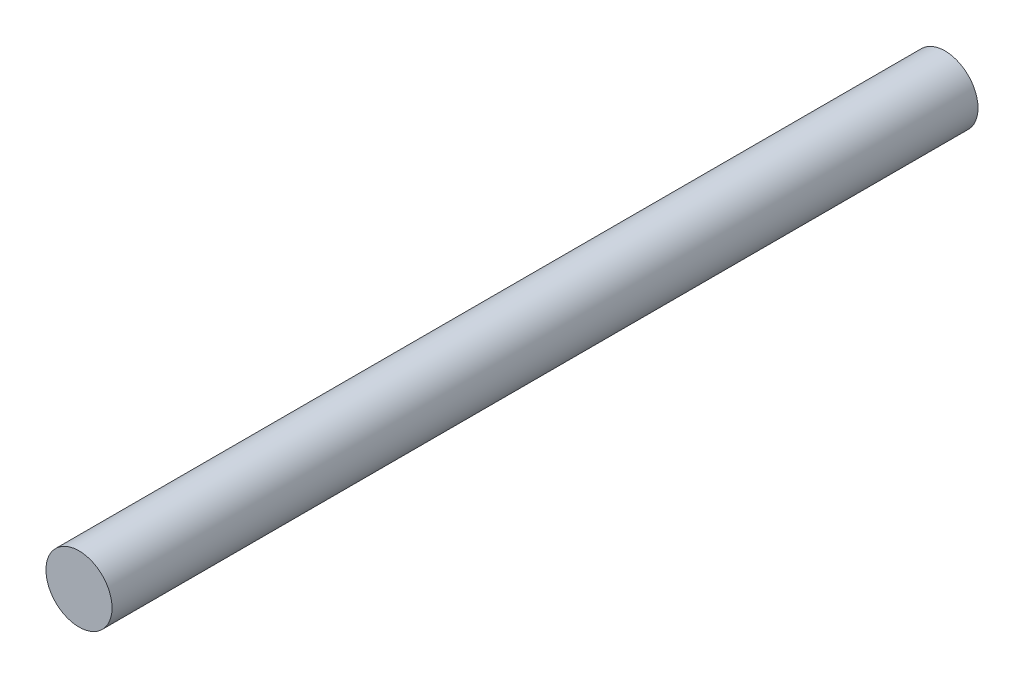
from build123d import *

# Parameters (mm, degrees)
SKETCH1_R           = 10
BOSS_EXTRUDE1_DEPTH = 262


with BuildPart() as part:
    # Sketch1 → Boss-Extrude1 (new body)
    with BuildSketch(Plane.XY):
        Circle(SKETCH1_R)
    extrude(amount=BOSS_EXTRUDE1_DEPTH)


solid = part.part
